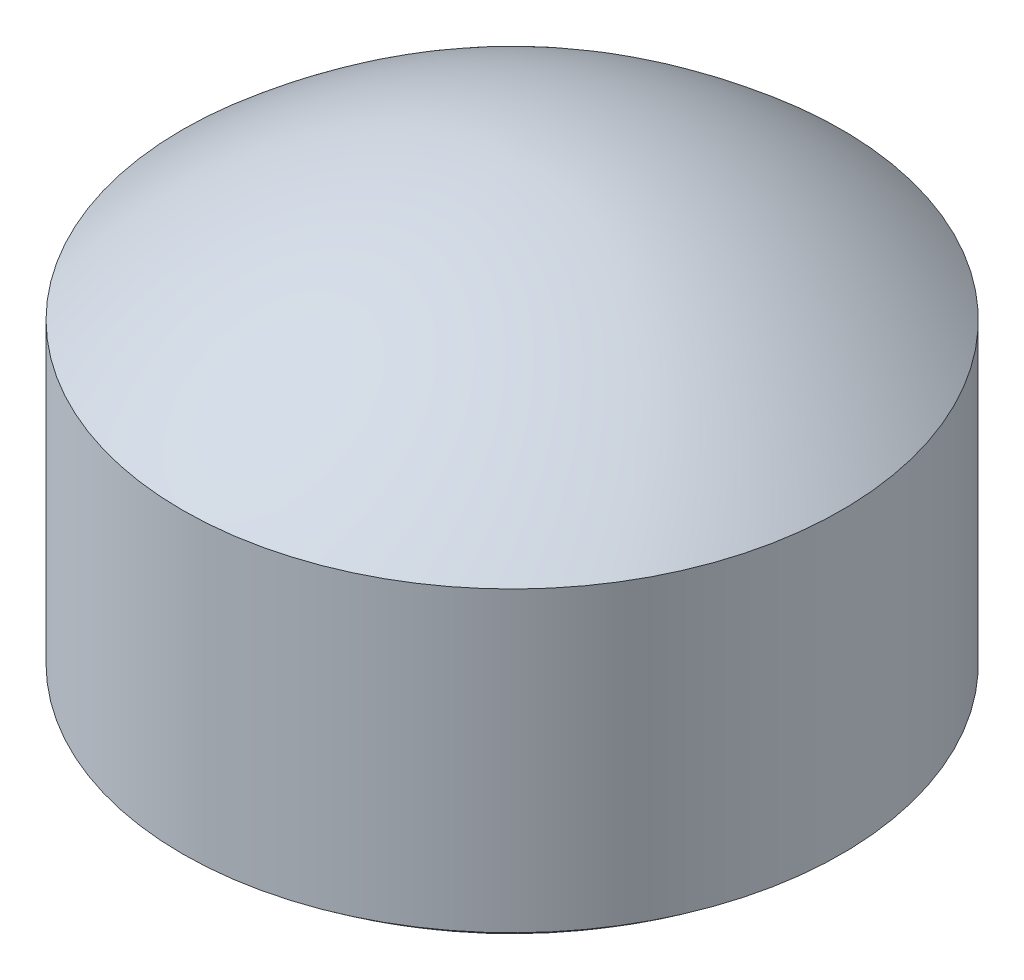
from build123d import *


with BuildPart() as part:
    # Sketch3 → Revolve4 (revolve)
    with BuildSketch(Plane.XY, mode=Mode.PRIVATE) as revolve4_sk:
        with BuildLine():
            Line((-11.721067324, 4.936241933), (-11.721067324, -4.936241933))
            add(Edge.make_bspline(
                [(-0.789590036, -8.867840545), (-6.650123698, -8.867840545), (-11.721067324, -4.936241933)],
                knots=[0.5, 0.5, 0.5, 1, 1, 1], degree=2))
            Line((-0.789590036, -8.867840545), (-0.789590036, 9.52842534))
            add(Edge.make_bspline(
                [(-0.789590036, 9.52842534), (-6.482424423, 9.423571495), (-11.721067324, 4.936241933)],
                knots=[0.514225132, 0.514225132, 0.514225132, 1, 1, 1], degree=2))
        make_face()
    revolve(revolve4_sk.sketch.rotate(Axis((-0.789590036, 9.52842534, 0), (0, -1, 0)), 270), axis=Axis((-0.789590036, 9.52842534, 0), (0, -1, 0)))


solid = part.part
